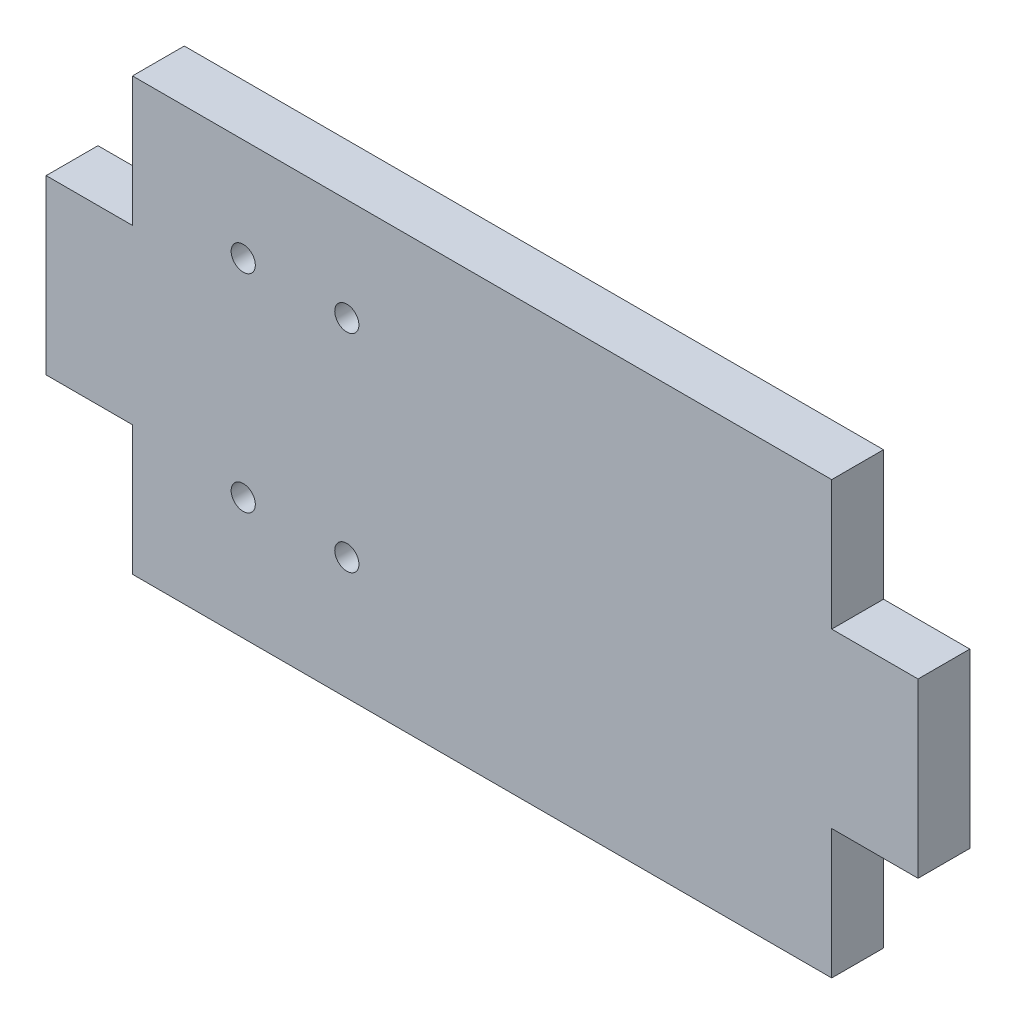
from build123d import *

# Parameters (mm, degrees)
ESQUISSE1_W             = 10
ESQUISSE1_H             = 20
ESQUISSE1_W_2           = 81
ESQUISSE1_H_2           = 50
BOSS_EXTRU_1_DEPTH      = 6
ESQUISSE2_R             = 1.4
ENL_V_MAT_EXTRU_1_DEPTH = 6
ESQUISSE3_R             = 3
ENL_V_MAT_EXTRU_2_DEPTH = 4


with BuildPart() as part:
    # Esquisse1 → Boss.-Extru.1 (new body)
    with BuildSketch(Plane.XY):
        with Locations((-5, 25)):
            Rectangle(ESQUISSE1_W, ESQUISSE1_H)
        with Locations((40.5, 25)):
            Rectangle(ESQUISSE1_W_2, ESQUISSE1_H_2)
        with Locations((86, 25)):
            Rectangle(ESQUISSE1_W, ESQUISSE1_H)
    extrude(amount=BOSS_EXTRU_1_DEPTH)

    # Esquisse2 → Enlèv. mat.-Extru.1 (cut)
    with BuildSketch(Plane(origin=(0, 0, 0), x_dir=(-1, 0, 0), z_dir=(0, 0, -1))):
        with Locations((-12.828927642, 14.12243627)):
            Circle(ESQUISSE2_R)
        with Locations((-12.828927642, 38.12243627)):
            Circle(ESQUISSE2_R)
        with Locations((-24.828927642, 38.12243627)):
            Circle(ESQUISSE2_R)
        with Locations((-24.828927642, 14.12243627)):
            Circle(ESQUISSE2_R)
    extrude(amount=-ENL_V_MAT_EXTRU_1_DEPTH, mode=Mode.SUBTRACT)

    # Esquisse3 → Enlèv. mat.-Extru.2 (cut)
    with BuildSketch(Plane(origin=(0, 0, 0), x_dir=(-1, 0, 0), z_dir=(0, 0, -1))):
        with Locations((-24.828927642, 38.12243627)):
            Circle(ESQUISSE3_R)
        with Locations((-12.828927642, 38.12243627)):
            Circle(ESQUISSE3_R)
        with Locations((-12.828927642, 14.12243627)):
            Circle(ESQUISSE3_R)
        with Locations((-24.828927642, 14.12243627)):
            Circle(ESQUISSE3_R)
    extrude(amount=-ENL_V_MAT_EXTRU_2_DEPTH, mode=Mode.SUBTRACT)


solid = part.part
